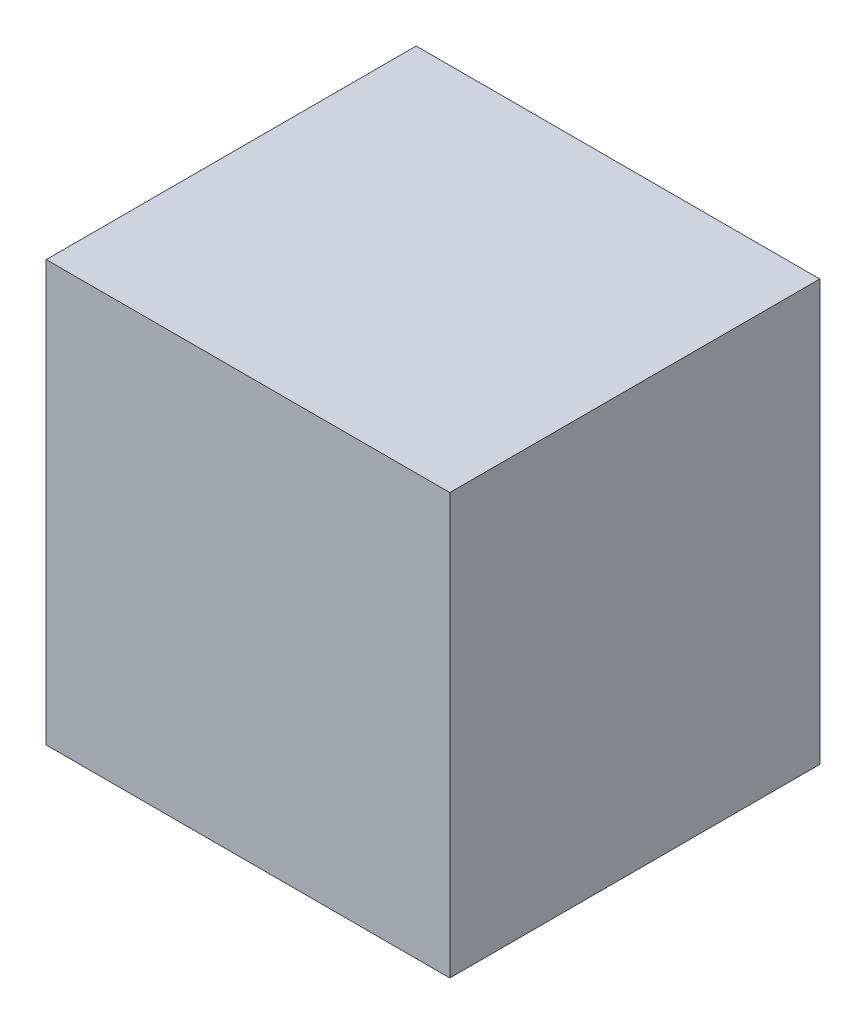
from build123d import *

# Parameters (mm, degrees)
SKETCH1_W           = 76.2
SKETCH1_H           = 69.85
BOSS_EXTRUDE1_DEPTH = 79.375


with BuildPart() as part:
    # Sketch1 → Boss-Extrude1 (new body)
    with BuildSketch(Plane(origin=(0, 0, 0), x_dir=(1, 0, 0), z_dir=(0, 1, 0))):
        with Locations((38.1, 34.925)):
            Rectangle(SKETCH1_W, SKETCH1_H)
    extrude(amount=BOSS_EXTRUDE1_DEPTH)


solid = part.part
